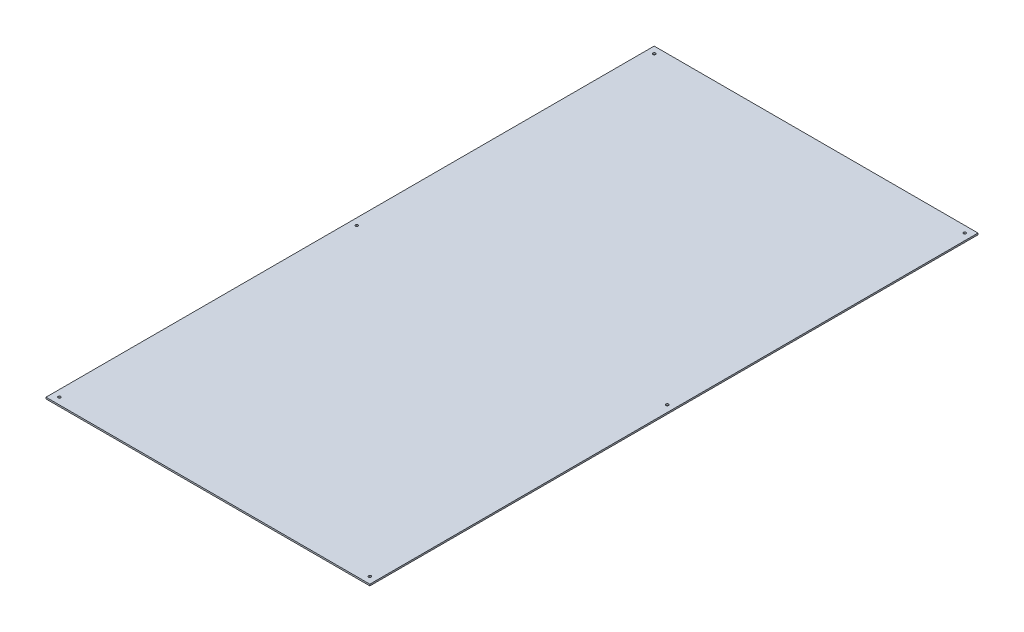
from build123d import *

# Parameters (mm, degrees)
SKETCH1_W           = 582
SKETCH1_H           = 1093
SKETCH1_R           = 2.38125
BOSS_EXTRUDE1_DEPTH = 2.8


with BuildPart() as part:
    # Sketch1 → Boss-Extrude1 (new body)
    with BuildSketch(Plane(origin=(0, 0, 0), x_dir=(1, 0, 0), z_dir=(0, 1, 0))):
        Rectangle(SKETCH1_W, SKETCH1_H)
        with Locations(Location((279, 534.5, 0), (0, 0, 270))):
            Circle(SKETCH1_R, mode=Mode.SUBTRACT)
        with Locations(Location((-279, 534.5, 0), (0, 0, 270))):
            Circle(SKETCH1_R, mode=Mode.SUBTRACT)
        with Locations(Location((-279, 0, 0), (0, 0, 270))):
            Circle(SKETCH1_R, mode=Mode.SUBTRACT)
        with Locations(Location((279, 0, 0), (0, 0, 270))):
            Circle(SKETCH1_R, mode=Mode.SUBTRACT)
        with Locations(Location((-279, -534.5, 0), (0, 0, 270))):
            Circle(SKETCH1_R, mode=Mode.SUBTRACT)
        with Locations(Location((279, -534.5, 0), (0, 0, 270))):
            Circle(SKETCH1_R, mode=Mode.SUBTRACT)
    extrude(amount=BOSS_EXTRUDE1_DEPTH)


solid = part.part
